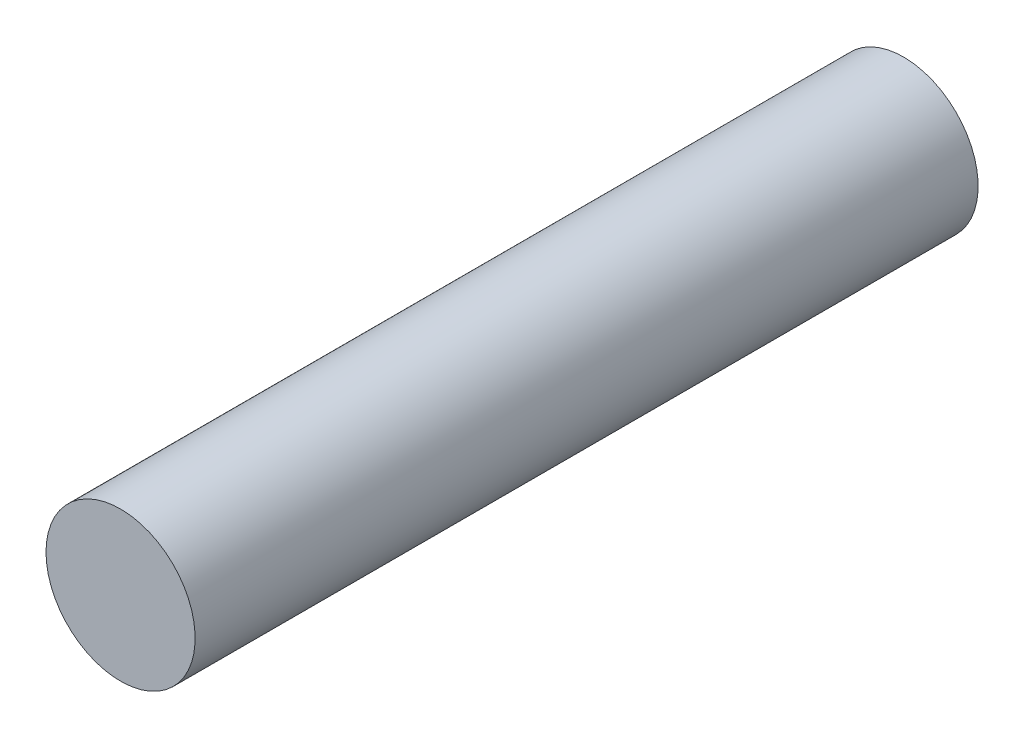
from build123d import *

# Parameters (mm, degrees)
SKETCH1_R           = 2
BOSS_EXTRUDE1_DEPTH = 21


with BuildPart() as part:
    # Sketch1 → Boss-Extrude1 (new body)
    with BuildSketch(Plane.XY):
        with Locations(Location((0, 0, 0), (0, 0, 180))):
            Circle(SKETCH1_R)
    extrude(amount=BOSS_EXTRUDE1_DEPTH)


solid = part.part
